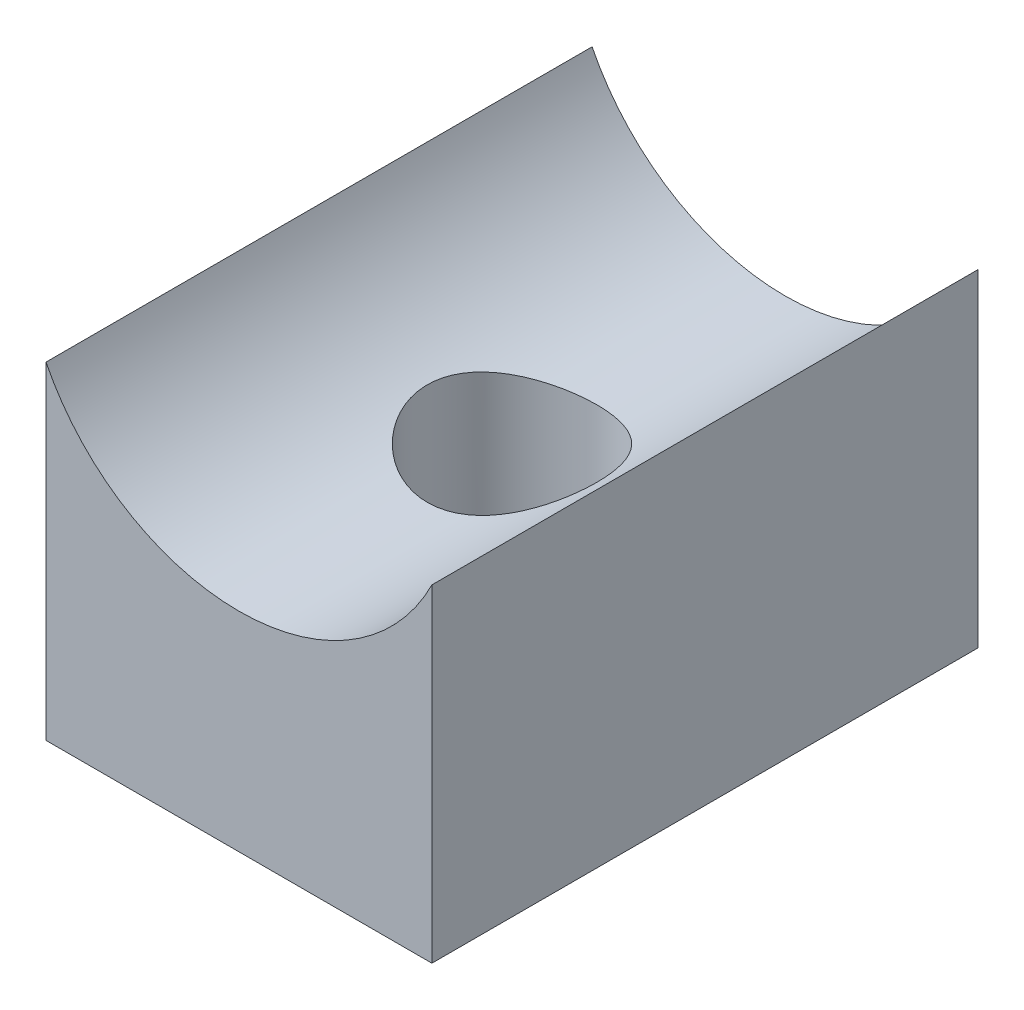
from build123d import *

# Parameters (mm, degrees)
BOSS_EXTRUDE1_DEPTH     = 5
CUT_EXTRUDE1_REACH      = 10.572
CUT_EXTRUDE1_END_RADIUS = 3.95
SKETCH2_R               = 1.55


with BuildPart() as part:
    # Sketch1 → Boss-Extrude1 (new, symmetric)
    with BuildSketch(Plane.XY):
        with BuildLine():
            Line((-3.533271058, -6), (3.533271058, -6))
            Line((3.533271058, -6), (3.533271058, 0))
            ThreePointArc((3.533271058, 0), (0, -2.184073719), (-3.533271058, 0))
            Line((-3.533271058, 0), (-3.533271058, -6))
        make_face()
    extrude(amount=BOSS_EXTRUDE1_DEPTH, both=True)

    # Cut-Extrude1: up to this cylinder (the profile starts outside it)
    cut_extrude1_end = Plane(origin=(0, 1.765926281, 0), z_dir=(0, 0, -1)) * Cylinder(CUT_EXTRUDE1_END_RADIUS, 30.044, mode=Mode.PRIVATE)
    # Sketch2 → Cut-Extrude1 (cut, up to the surface)
    with BuildSketch(Plane(origin=(0, -6, 0), x_dir=(-1, 0, 0), z_dir=(0, -1, 0)), mode=Mode.PRIVATE) as cut_extrude1_sk1:
        with Locations(Location((0, 0, 0), (0, 0, 90))):
            Circle(SKETCH2_R)
    cut_extrude1_tool1 = extrude(cut_extrude1_sk1.sketch, amount=-CUT_EXTRUDE1_REACH, mode=Mode.PRIVATE) - cut_extrude1_end
    add(cut_extrude1_tool1.solids().sort_by_distance((0, -6, 0))[0], mode=Mode.SUBTRACT)


solid = part.part
